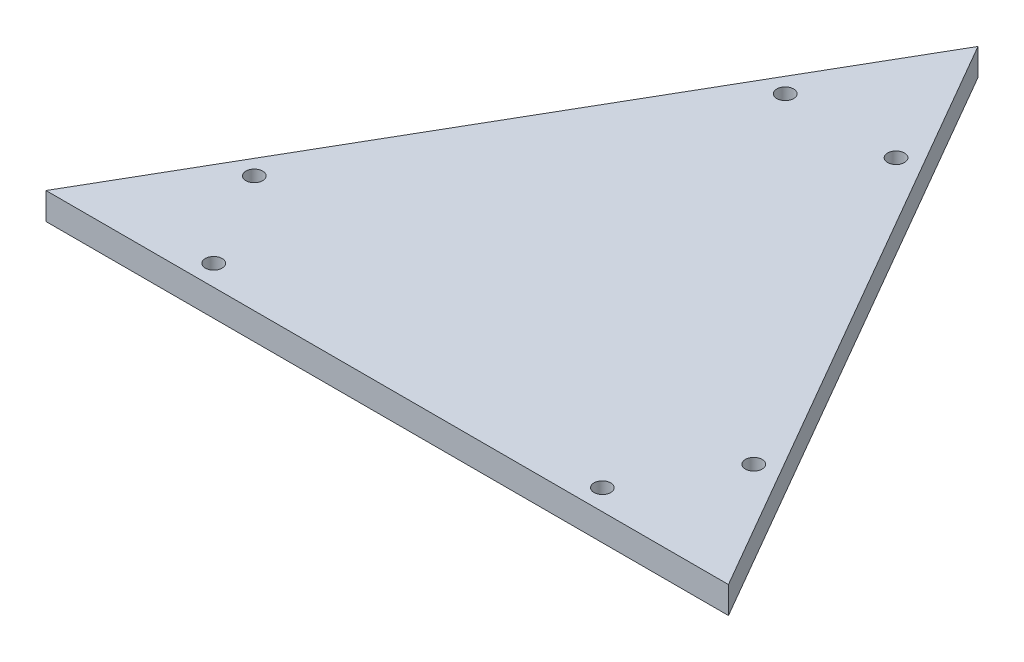
from build123d import *

# Parameters (mm, degrees)
SALIENTE_EXTRUIR2_DEPTH = 8
CROQUIS3_R              = 2.5
CORTAR_EXTRUIR1_DEPTH   = 31


with BuildPart() as part:
    # Croquis1 → Saliente-Extruir2 (new body)
    with BuildSketch(Plane(origin=(0, 0, 0), x_dir=(1, 0, 0), z_dir=(0, 1, 0))):
        Polygon((101.602540378, 0), (0, 175.908017141), (-101.602540378, 0), align=None)
    extrude(amount=SALIENTE_EXTRUIR2_DEPTH)

    # Croquis3 → Cortar-Extruir1 (cut)
    with BuildSketch(Plane(origin=(0, 8, 0), x_dir=(1, 0, 0), z_dir=(0, 1, 0))):
        with Locations(Location((-16.5, 135, 0), (0, 0, 270))):
            Circle(CROQUIS3_R)
        with Locations(Location((16.5, 135, 0), (0, 0, 270))):
            Circle(CROQUIS3_R)
        with Locations(Location((-57.862159322, 6.200961894, 0), (0, 0, 270))):
            Circle(CROQUIS3_R)
        with Locations(Location((-74.362159322, 34.779800219, 0), (0, 0, 270))):
            Circle(CROQUIS3_R)
        with Locations(Location((57.862159322, 6.200961894, 0), (0, 0, 270))):
            Circle(CROQUIS3_R)
        with Locations(Location((74.362159322, 34.779800219, 0), (0, 0, 270))):
            Circle(CROQUIS3_R)
    extrude(amount=-CORTAR_EXTRUIR1_DEPTH, mode=Mode.SUBTRACT)


solid = part.part
